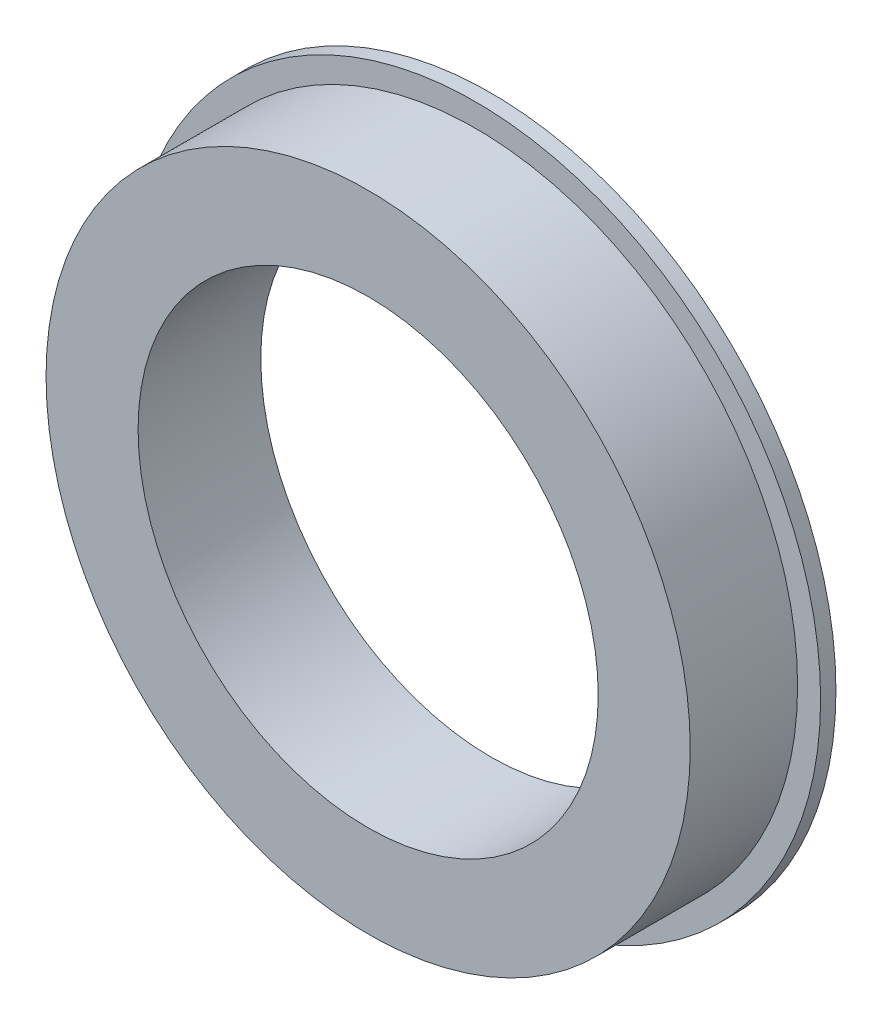
from build123d import *

# Parameters (mm, degrees)
SKETCH1_R           = 10.5
SKETCH1_R_2         = 7.5
BOSS_EXTRUDE1_DEPTH = 4
SKETCH1_3_R         = 11.25
SKETCH1_3_R_2       = 10.5
BOSS_EXTRUDE2_DEPTH = 0.5


with BuildPart() as part:
    # Sketch1 → Boss-Extrude1 (new body)
    with BuildSketch(Plane.XY):
        Circle(SKETCH1_R)
        Circle(SKETCH1_R_2, mode=Mode.SUBTRACT)
    extrude(amount=BOSS_EXTRUDE1_DEPTH)

    # Sketch1<3> → Boss-Extrude2 (add)
    with BuildSketch(Plane.XY):
        Circle(SKETCH1_3_R)
        Circle(SKETCH1_3_R_2, mode=Mode.SUBTRACT)
    extrude(amount=BOSS_EXTRUDE2_DEPTH)


solid = part.part
